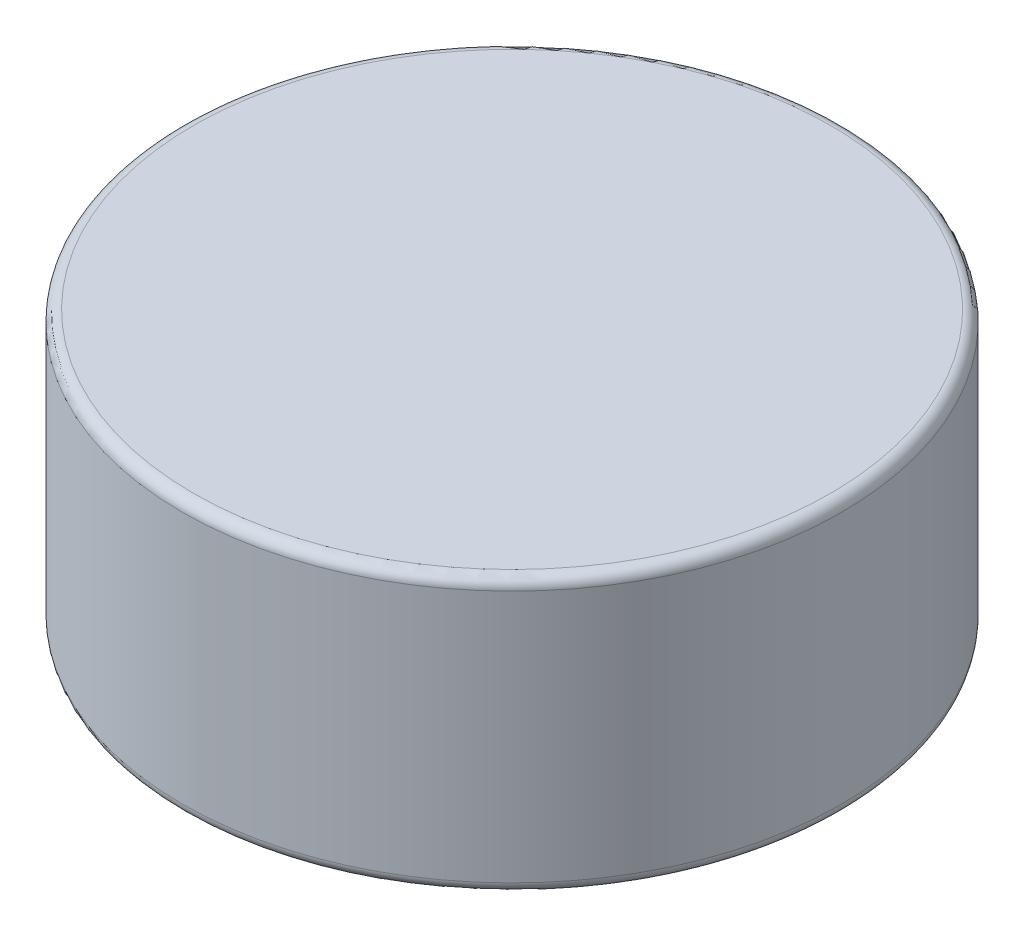
from build123d import *

# Parameters (mm, degrees)
SKETCH1_R           = 3
BOSS_EXTRUDE1_DEPTH = 1.25
FILLET1_R           = 0.1


with BuildPart() as part:
    # Sketch1 → Boss-Extrude1 (new, symmetric)
    with BuildSketch(Plane(origin=(0, 0, 0), x_dir=(1, 0, 0), z_dir=(0, 1, 0))):
        with Locations(Location((0, 0, 0), (0, 0, 270))):
            Circle(SKETCH1_R)
    extrude(amount=BOSS_EXTRUDE1_DEPTH, both=True)

    # Fillet1
    fillet1_edges = [part.edges().sort_by_distance(p)[0] for p in [
        (0, -1.25, -3),
        (0, 1.25, -3),
    ]]
    fillet(fillet1_edges, radius=FILLET1_R)


solid = part.part
